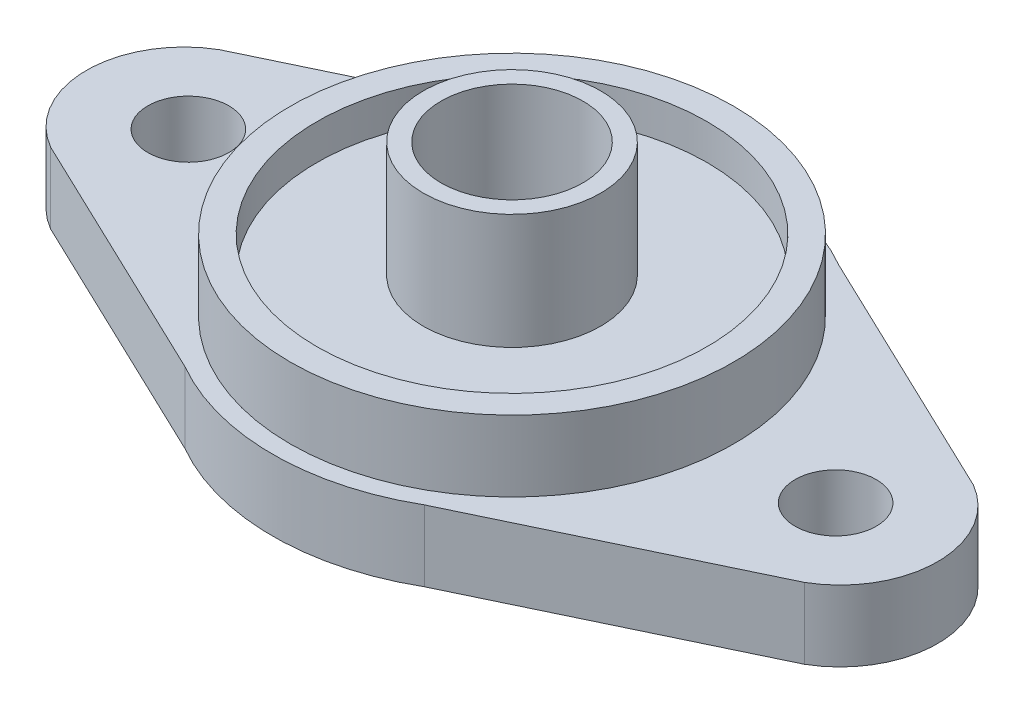
from build123d import *

# Parameters (mm, degrees)
BOSS_EXTRUDE1_DEPTH = 4
SKETCH1_3_R         = 12.5
SKETCH1_3_R_2       = 11
BOSS_EXTRUDE2_DEPTH = 8
SKETCH1_4_R         = 5
SKETCH1_4_R_2       = 4
BOSS_EXTRUDE3_DEPTH = 12.5
SKETCH3_R           = 11
SKETCH3_R_2         = 5
BOSS_EXTRUDE4_DEPTH = 2
SKETCH1_5_R         = 4
SKETCH1_5_R_2       = 2.285917385
CUT_EXTRUDE1_DEPTH  = 31.24070105


with BuildPart() as part:
    # Sketch1 → Boss-Extrude1 (new body)
    with BuildSketch(Plane(origin=(0, 0, 0), x_dir=(1, 0, 0), z_dir=(0, 1, 0))):
        with BuildLine():
            Line((-21.25, 4.763139721), (-6.75, 11.691342951))
            ThreePointArc((-6.75, 11.691342951), (0, 13.5), (6.75, 11.691342951))
            Line((6.75, 11.691342951), (21.25, 4.763139721))
            ThreePointArc((21.25, 4.763139721), (24, 0), (21.25, -4.763139721))
            Line((21.25, -4.763139721), (6.75, -11.691342951))
            ThreePointArc((6.75, -11.691342951), (0, -13.5), (-6.75, -11.691342951))
            Line((-6.75, -11.691342951), (-21.25, -4.763139721))
            ThreePointArc((-21.25, -4.763139721), (-24, 0), (-21.25, 4.763139721))
        make_face()
    extrude(amount=BOSS_EXTRUDE1_DEPTH)

    # Sketch1<3> → Boss-Extrude2 (add)
    with BuildSketch(Plane(origin=(0, 0, 0), x_dir=(1, 0, 0), z_dir=(0, 1, 0))):
        Circle(SKETCH1_3_R)
        Circle(SKETCH1_3_R_2, mode=Mode.SUBTRACT)
    extrude(amount=BOSS_EXTRUDE2_DEPTH)

    # Sketch1<4> → Boss-Extrude3 (add)
    with BuildSketch(Plane(origin=(0, 0, 0), x_dir=(1, 0, 0), z_dir=(0, 1, 0))):
        Circle(SKETCH1_4_R)
        Circle(SKETCH1_4_R_2, mode=Mode.SUBTRACT)
    extrude(amount=BOSS_EXTRUDE3_DEPTH)

    # Sketch3 → Boss-Extrude4 (add)
    with BuildSketch(Plane(origin=(0, 4, 0), x_dir=(1, 0, 0), z_dir=(0, 1, 0))):
        Circle(SKETCH3_R)
        Circle(SKETCH3_R_2, mode=Mode.SUBTRACT)
    extrude(amount=BOSS_EXTRUDE4_DEPTH)

    # Sketch1<5> → Cut-Extrude1 (cut, through all)
    with BuildSketch(Plane(origin=(0, 0, 0), x_dir=(1, 0, 0), z_dir=(0, 1, 0))):
        Circle(SKETCH1_5_R)
        with Locations((18.25, 0)):
            Circle(SKETCH1_5_R_2)
        with Locations((-18.25, 0)):
            Circle(SKETCH1_5_R_2)
    extrude(amount=CUT_EXTRUDE1_DEPTH, mode=Mode.SUBTRACT)


solid = part.part
